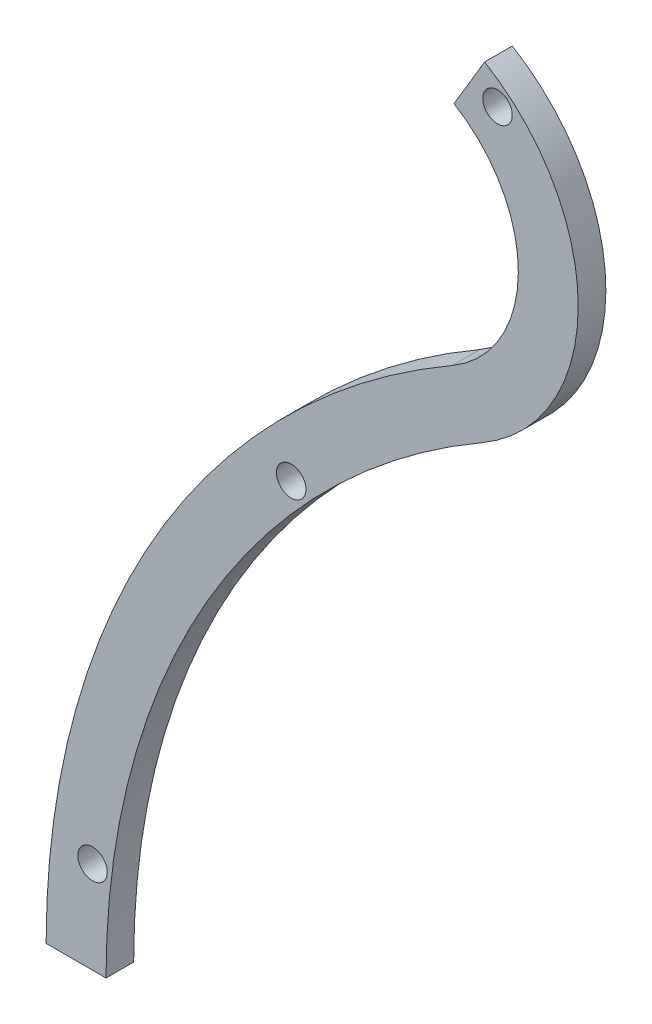
from build123d import *

# Parameters (mm, degrees)
SKETCH1_R           = 1.6
BOSS_EXTRUDE1_DEPTH = 3


with BuildPart() as part:
    # Sketch1 → Boss-Extrude1 (new body)
    with BuildSketch(Plane.XY):
        with BuildLine():
            Line((-36.934217786, 0), (-30.434217786, 0))
            ThreePointArc((-30.434217786, 0), (-19.491470952, 40.838887158), (10.404669372, 70.735027482))
            ThreePointArc((10.404669372, 70.735027482), (20.808844345, 88.613000102), (10.652125885, 106.632706869))
            Line((10.652125885, 106.632706869), (7.324830428, 101.048881572))
            ThreePointArc((7.324830428, 101.048881572), (14.308998775, 88.657806037), (7.154669372, 76.364192606))
            ThreePointArc((7.154669372, 76.364192606), (-25.120636077, 44.088887158), (-36.934217786, 0))
        make_face()
        with Locations((12.048125899, 103.114840794)):
            Circle(SKETCH1_R, mode=Mode.SUBTRACT)
        with Locations((-10.337645521, 56.751553408)):
            Circle(SKETCH1_R, mode=Mode.SUBTRACT)
        with Locations((-31.900795415, 10)):
            Circle(SKETCH1_R, mode=Mode.SUBTRACT)
    extrude(amount=BOSS_EXTRUDE1_DEPTH)


solid = part.part
